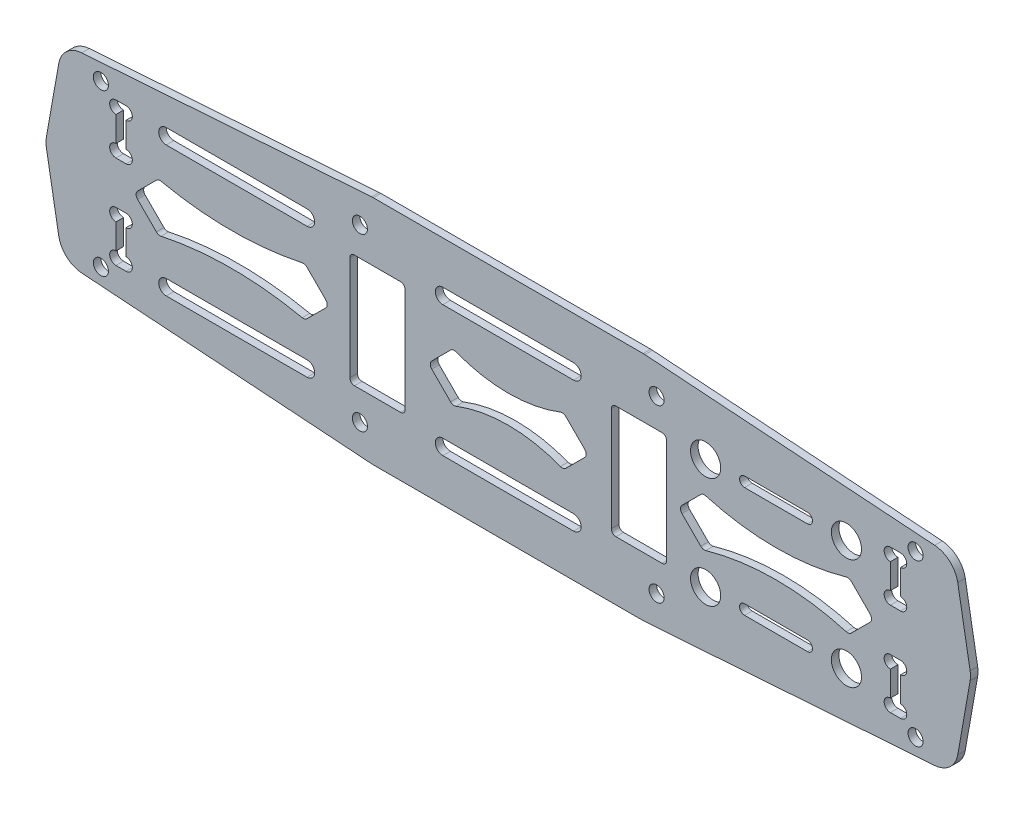
from build123d import *

# Parameters (mm, degrees)
CROQUIS1_R              = 3
CROQUIS1_R_2            = 1.5
SALIENTE_EXTRUIR1_DEPTH = 1.5


with BuildPart() as part:
    # Croquis1 → Saliente-Extruir1 (new body)
    with BuildSketch(Plane.XY.offset(1.5)):
        with BuildLine():
            Line((-84.808392572, -18.957643404), (-27.174178521, -22.987820251))
            ThreePointArc((-27.174178521, -22.987820251), (-26.999893636, -22.996954135), (-26.825396153, -23))
            Line((-26.825396153, -23), (26.825396153, -23))
            ThreePointArc((26.825396153, -23), (26.999893636, -22.996954135), (27.174178521, -22.987820251))
            Line((27.174178521, -22.987820251), (84.808392572, -18.957643404))
            ThreePointArc((84.808392572, -18.957643404), (87.805263235, -17.68554728), (89.383648968, -14.838064041))
            Line((89.383648968, -14.838064041), (91.846905706, -0.868240888))
            ThreePointArc((91.846905706, -0.868240888), (91.922866941, 0), (91.846905706, 0.868240888))
            Line((91.846905706, 0.868240888), (89.383648968, 14.838064041))
            ThreePointArc((89.383648968, 14.838064041), (87.805263235, 17.68554728), (84.808392572, 18.957643404))
            Line((84.808392572, 18.957643404), (27.174178521, 22.987820251))
            ThreePointArc((27.174178521, 22.987820251), (26.999893636, 22.996954135), (26.825396153, 23))
            Line((26.825396153, 23), (-26.825396153, 23))
            ThreePointArc((-26.825396153, 23), (-26.999893636, 22.996954135), (-27.174178521, 22.987820251))
            Line((-27.174178521, 22.987820251), (-84.808392572, 18.957643404))
            ThreePointArc((-84.808392572, 18.957643404), (-87.805263235, 17.68554728), (-89.383648968, 14.838064041))
            Line((-89.383648968, 14.838064041), (-91.846905706, 0.868240888))
            ThreePointArc((-91.846905706, 0.868240888), (-91.922866941, 0), (-91.846905706, -0.868240888))
            Line((-91.846905706, -0.868240888), (-89.383648968, -14.838064041))
            ThreePointArc((-89.383648968, -14.838064041), (-87.805263235, -17.68554728), (-84.808392572, -18.957643404))
        make_face()
        with Locations((39.25, 11)):
            Circle(CROQUIS1_R, mode=Mode.SUBTRACT)
        with Locations((67.25, 11)):
            Circle(CROQUIS1_R, mode=Mode.SUBTRACT)
        with Locations((39.25, -11)):
            Circle(CROQUIS1_R, mode=Mode.SUBTRACT)
        with Locations((67.25, -11)):
            Circle(CROQUIS1_R, mode=Mode.SUBTRACT)
        with Locations((81, 16)):
            Circle(CROQUIS1_R_2, mode=Mode.SUBTRACT)
        with Locations((29.5, 17)):
            Circle(CROQUIS1_R_2, mode=Mode.SUBTRACT)
        with Locations((-29.5, 17)):
            Circle(CROQUIS1_R_2, mode=Mode.SUBTRACT)
        with Locations((-81, 16)):
            Circle(CROQUIS1_R_2, mode=Mode.SUBTRACT)
        with Locations((-29.5, -17)):
            Circle(CROQUIS1_R_2, mode=Mode.SUBTRACT)
        with Locations((29.5, -17)):
            Circle(CROQUIS1_R_2, mode=Mode.SUBTRACT)
        with Locations((-81, -16)):
            Circle(CROQUIS1_R_2, mode=Mode.SUBTRACT)
        with Locations((81, -16)):
            Circle(CROQUIS1_R_2, mode=Mode.SUBTRACT)
        with BuildLine():
            Line((11.457106781, 4.457106781), (15.207106781, 0.707106781))
            ThreePointArc((15.207106781, 0.707106781), (15.5, 0), (15.207106781, -0.707106781))
            Line((15.207106781, -0.707106781), (11.457106781, -4.457106781))
            ThreePointArc((11.457106781, -4.457106781), (10.957242702, -4.72828956), (10.390355463, -4.683089388))
            ThreePointArc((10.390355463, -4.683089388), (0, -2.75), (-10.390355463, -4.683089388))
            ThreePointArc((-10.390355463, -4.683089388), (-10.957242702, -4.72828956), (-11.457106781, -4.457106781))
            Line((-11.457106781, -4.457106781), (-15.207106781, -0.707106781))
            ThreePointArc((-15.207106781, -0.707106781), (-15.5, 0), (-15.207106781, 0.707106781))
            Line((-15.207106781, 0.707106781), (-11.457106781, 4.457106781))
            ThreePointArc((-11.457106781, 4.457106781), (-10.957242702, 4.72828956), (-10.390355463, 4.683089388))
            ThreePointArc((-10.390355463, 4.683089388), (0, 2.75), (10.390355463, 4.683089388))
            ThreePointArc((10.390355463, 4.683089388), (10.957242702, 4.72828956), (11.457106781, 4.457106781))
        make_face(mode=Mode.SUBTRACT)
        with BuildLine():
            Line((-40, 11.5), (-68, 11.5))
            ThreePointArc((-68, 11.5), (-69.5, 13), (-68, 14.5))
            Line((-68, 14.5), (-40, 14.5))
            ThreePointArc((-40, 14.5), (-38.5, 13), (-40, 11.5))
        make_face(mode=Mode.SUBTRACT)
        with BuildLine():
            Line((-40, -14.5), (-68, -14.5))
            ThreePointArc((-68, -14.5), (-69.5, -13), (-68, -11.5))
            Line((-68, -11.5), (-40, -11.5))
            ThreePointArc((-40, -11.5), (-38.5, -13), (-40, -14.5))
        make_face(mode=Mode.SUBTRACT)
        with BuildLine():
            Line((13, 11.5), (-13, 11.5))
            ThreePointArc((-13, 11.5), (-14.5, 13), (-13, 14.5))
            Line((-13, 14.5), (13, 14.5))
            ThreePointArc((13, 14.5), (14.5, 13), (13, 11.5))
        make_face(mode=Mode.SUBTRACT)
        with BuildLine():
            Line((13, -14.5), (-13, -14.5))
            ThreePointArc((-13, -14.5), (-14.5, -13), (-13, -11.5))
            Line((-13, -11.5), (13, -11.5))
            ThreePointArc((13, -11.5), (14.5, -13), (13, -14.5))
        make_face(mode=Mode.SUBTRACT)
        with BuildLine():
            Line((-21.414157995, -11.25), (-30.585842005, -11.25))
            ThreePointArc((-30.585842005, -11.25), (-31.232249322, -10.982249322), (-31.5, -10.335842005))
            Line((-31.5, -10.335842005), (-31.5, 10.335842005))
            ThreePointArc((-31.5, 10.335842005), (-31.232249322, 10.982249322), (-30.585842005, 11.25))
            Line((-30.585842005, 11.25), (-21.414157995, 11.25))
            ThreePointArc((-21.414157995, 11.25), (-20.767750678, 10.982249322), (-20.5, 10.335842005))
            Line((-20.5, 10.335842005), (-20.5, -10.335842005))
            ThreePointArc((-20.5, -10.335842005), (-20.767750678, -10.982249322), (-21.414157995, -11.25))
        make_face(mode=Mode.SUBTRACT)
        with BuildLine():
            Line((20.5, -10.335842005), (20.5, 10.335842005))
            ThreePointArc((20.5, 10.335842005), (20.767750678, 10.982249322), (21.414157995, 11.25))
            Line((21.414157995, 11.25), (30.585842005, 11.25))
            ThreePointArc((30.585842005, 11.25), (31.232249322, 10.982249322), (31.5, 10.335842005))
            Line((31.5, 10.335842005), (31.5, -10.335842005))
            ThreePointArc((31.5, -10.335842005), (31.232249322, -10.982249322), (30.585842005, -11.25))
            Line((30.585842005, -11.25), (21.414157995, -11.25))
            ThreePointArc((21.414157995, -11.25), (20.767750678, -10.982249322), (20.5, -10.335842005))
        make_face(mode=Mode.SUBTRACT)
        with BuildLine():
            Line((59.5, 10), (47, 10))
            ThreePointArc((47, 10), (46, 11), (47, 12))
            Line((47, 12), (59.5, 12))
            ThreePointArc((59.5, 12), (60.5, 11), (59.5, 10))
        make_face(mode=Mode.SUBTRACT)
        with BuildLine():
            Line((59.5, -12), (47, -12))
            ThreePointArc((47, -12), (46, -11), (47, -10))
            Line((47, -10), (59.5, -10))
            ThreePointArc((59.5, -10), (60.5, -11), (59.5, -12))
        make_face(mode=Mode.SUBTRACT)
        with BuildLine():
            Line((78, -6.75), (78, -11.75))
            ThreePointArc((78, -11.75), (79.25, -13), (78, -14.25))
            Line((78, -14.25), (76, -14.25))
            ThreePointArc((76, -14.25), (74.75, -13), (76, -11.75))
            Line((76, -11.75), (76, -6.75))
            ThreePointArc((76, -6.75), (74.75, -5.5), (76, -4.25))
            Line((76, -4.25), (78, -4.25))
            ThreePointArc((78, -4.25), (79.25, -5.5), (78, -6.75))
        make_face(mode=Mode.SUBTRACT)
        with BuildLine():
            Line((78, 4.25), (76, 4.25))
            ThreePointArc((76, 4.25), (74.75, 5.5), (76, 6.75))
            Line((76, 6.75), (76, 11.75))
            ThreePointArc((76, 11.75), (74.75, 13), (76, 14.25))
            Line((76, 14.25), (78, 14.25))
            ThreePointArc((78, 14.25), (79.25, 13), (78, 11.75))
            Line((78, 11.75), (78, 6.75))
            ThreePointArc((78, 6.75), (79.25, 5.5), (78, 4.25))
        make_face(mode=Mode.SUBTRACT)
        with BuildLine():
            Line((-76, 4.25), (-78, 4.25))
            ThreePointArc((-78, 4.25), (-79.25, 5.5), (-78, 6.75))
            Line((-78, 6.75), (-78, 11.75))
            ThreePointArc((-78, 11.75), (-79.25, 13), (-78, 14.25))
            Line((-78, 14.25), (-76, 14.25))
            ThreePointArc((-76, 14.25), (-74.75, 13), (-76, 11.75))
            Line((-76, 11.75), (-76, 6.75))
            ThreePointArc((-76, 6.75), (-74.75, 5.5), (-76, 4.25))
        make_face(mode=Mode.SUBTRACT)
        with BuildLine():
            Line((-76, -14.25), (-78, -14.25))
            ThreePointArc((-78, -14.25), (-79.25, -13), (-78, -11.75))
            Line((-78, -11.75), (-78, -6.75))
            ThreePointArc((-78, -6.75), (-79.25, -5.5), (-78, -4.25))
            Line((-78, -4.25), (-76, -4.25))
            ThreePointArc((-76, -4.25), (-74.75, -5.5), (-76, -6.75))
            Line((-76, -6.75), (-76, -11.75))
            ThreePointArc((-76, -11.75), (-74.75, -13), (-76, -14.25))
        make_face(mode=Mode.SUBTRACT)
        with BuildLine():
            Line((-40.042893219, 4.457106781), (-36.292893219, 0.707106781))
            ThreePointArc((-36.292893219, 0.707106781), (-36, 0), (-36.292893219, -0.707106781))
            Line((-36.292893219, -0.707106781), (-40.042893219, -4.457106781))
            ThreePointArc((-40.042893219, -4.457106781), (-40.46613537, -4.708864366), (-40.958219178, -4.728082192))
            ThreePointArc((-40.958219178, -4.728082192), (-55, -3.25), (-69.041780822, -4.728082192))
            ThreePointArc((-69.041780822, -4.728082192), (-69.53386463, -4.708864366), (-69.957106781, -4.457106781))
            Line((-69.957106781, -4.457106781), (-73.707106781, -0.707106781))
            ThreePointArc((-73.707106781, -0.707106781), (-74, 0), (-73.707106781, 0.707106781))
            Line((-73.707106781, 0.707106781), (-69.957106781, 4.457106781))
            ThreePointArc((-69.957106781, 4.457106781), (-69.53386463, 4.708864366), (-69.041780822, 4.728082192))
            ThreePointArc((-69.041780822, 4.728082192), (-55, 3.25), (-40.958219178, 4.728082192))
            ThreePointArc((-40.958219178, 4.728082192), (-40.46613537, 4.708864366), (-40.042893219, 4.457106781))
        make_face(mode=Mode.SUBTRACT)
        with BuildLine():
            Line((68.207106781, 4.457106781), (71.957106781, 0.707106781))
            ThreePointArc((71.957106781, 0.707106781), (72.25, 0), (71.957106781, -0.707106781))
            Line((71.957106781, -0.707106781), (68.207106781, -4.457106781))
            ThreePointArc((68.207106781, -4.457106781), (67.750560349, -4.718100982), (67.224720797, -4.711364322))
            ThreePointArc((67.224720797, -4.711364322), (53.25, -2.75), (39.275279203, -4.711364322))
            ThreePointArc((39.275279203, -4.711364322), (38.749439651, -4.718100982), (38.292893219, -4.457106781))
            Line((38.292893219, -4.457106781), (34.542893219, -0.707106781))
            ThreePointArc((34.542893219, -0.707106781), (34.25, 0), (34.542893219, 0.707106781))
            Line((34.542893219, 0.707106781), (38.292893219, 4.457106781))
            ThreePointArc((38.292893219, 4.457106781), (38.749439651, 4.718100982), (39.275279203, 4.711364322))
            ThreePointArc((39.275279203, 4.711364322), (53.25, 2.75), (67.224720797, 4.711364322))
            ThreePointArc((67.224720797, 4.711364322), (67.750560349, 4.718100982), (68.207106781, 4.457106781))
        make_face(mode=Mode.SUBTRACT)
    extrude(amount=-SALIENTE_EXTRUIR1_DEPTH)


solid = part.part
